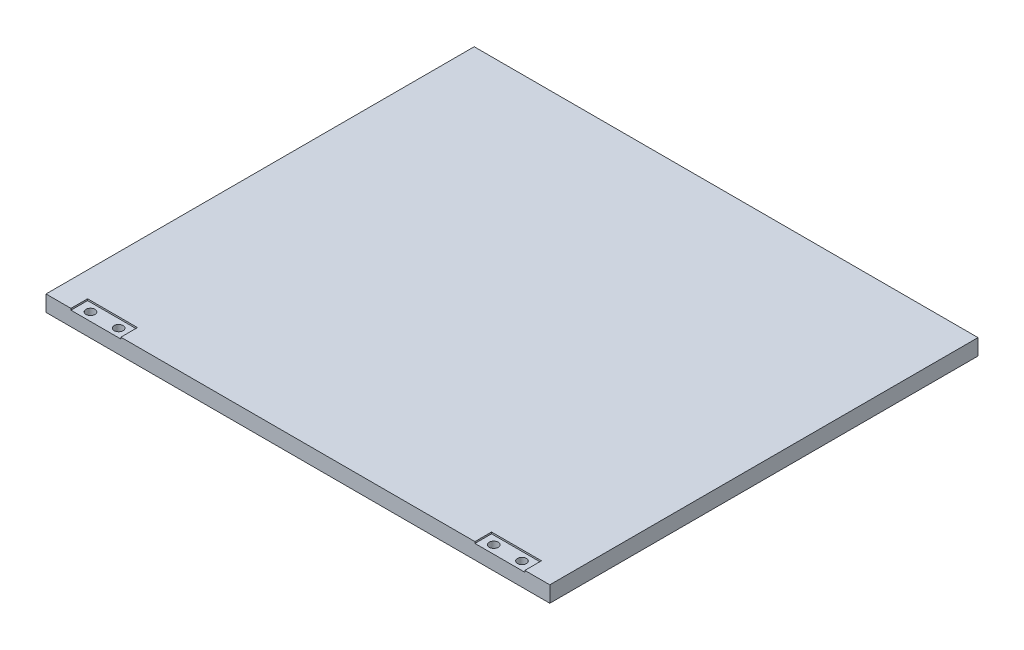
from build123d import *

# Parameters (mm, degrees)
SKETCH1_W               = 200
SKETCH1_H               = 170
F_1_4_STEEL_PLATE_DEPTH = 6.35
SKETCH2_W               = 19.812
SKETCH2_H               = 6.604
BLADEHINGECUT_DEPTH     = 0.635
BLADEHINGEHOLE_D        = 3.556
SKETCH5_W               = 5.05
SKETCH5_H               = 5.05
BLADENUTCUT_DEPTH       = 2


with BuildPart() as part:
    # Sketch1 → 1/4" Steel Plate (new body)
    with BuildSketch(Plane(origin=(0, 0, 0), x_dir=(1, 0, 0), z_dir=(0, 1, 0))):
        Rectangle(SKETCH1_W, SKETCH1_H)
    extrude(amount=F_1_4_STEEL_PLATE_DEPTH)

    # Sketch2 → BladeHingeCut (cut)
    with BuildSketch(Plane(origin=(0, 6.35, 0), x_dir=(1, 0, 0), z_dir=(0, 1, 0))):
        with Locations((-80.188, -81.698)):
            Rectangle(SKETCH2_W, SKETCH2_H)
    bladehingecut = extrude(amount=-BLADEHINGECUT_DEPTH, mode=Mode.SUBTRACT)

    # BladeHingeHole (through all)
    with Locations(Plane(origin=(-74.473, 5.715, 81.698), x_dir=(0, 0, 1), z_dir=(0, 1, 0))):
        with Locations((0, 0), (0, -11.176)):
            bladehingehole = Hole(BLADEHINGEHOLE_D / 2)

    # Sketch5 → BladeNutCut (cut)
    with BuildSketch(Plane.XZ):
        with Locations((-85.649, 81.698)):
            Rectangle(SKETCH5_W, SKETCH5_H)
        with Locations((-74.473, 81.698)):
            Rectangle(SKETCH5_W, SKETCH5_H)
    bladenutcut = extrude(amount=-BLADENUTCUT_DEPTH, mode=Mode.SUBTRACT)

    # BladeHingeMirror: BladeHingeCut, BladeHingeHole, BladeNutCut across plane
    add(bladehingecut.mirror(Plane.ZY), mode=Mode.SUBTRACT)
    add(bladehingehole.mirror(Plane.ZY), mode=Mode.SUBTRACT)
    add(bladenutcut.mirror(Plane.ZY), mode=Mode.SUBTRACT)


solid = part.part
